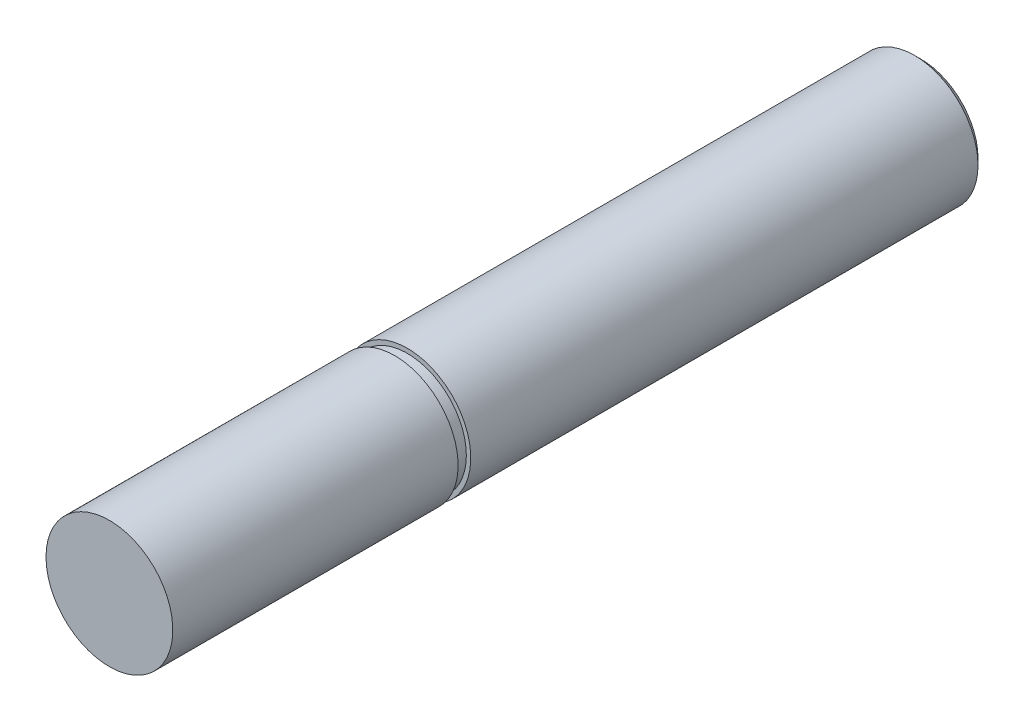
from build123d import *

# Parameters (mm, degrees)
SKETCH_1_R          = 5
EXTRUDE_1_DEPTH     = 104
SKETCH_2_W          = 3.498862739
SKETCH_2_H          = 1
CHAMFER_1_SIZE      = 0.5
SKETCH_4_W          = 44.49282487
SKETCH_4_H          = 52.981234512
CUT_EXTRUDE_2_DEPTH = 5


with BuildPart() as part:
    # 草图1 → 拉伸1 (new body)
    with BuildSketch(Plane.XY):
        with Locations(Location((0, 0, 0), (0, 0, 180))):
            Circle(SKETCH_1_R)
    extrude(amount=EXTRUDE_1_DEPTH)

    # 草图2 → 切除-旋转1 (revolve, cut)
    with BuildSketch(Plane(origin=(0, 0, 0), x_dir=(1, 0, 0), z_dir=(0, 1, 0)), mode=Mode.PRIVATE) as cut_revolve_1_sk:
        with Locations((6.39943137, -41)):
            Rectangle(SKETCH_2_W, SKETCH_2_H)
    revolve(cut_revolve_1_sk.sketch.rotate(Axis((0, 0, 104), (0, 0, -1)), 180), axis=Axis((0, 0, 104), (0, 0, -1)), mode=Mode.SUBTRACT)

    # 倒角1
    chamfer_1_edges = [part.edges().sort_by_distance(p)[0] for p in [
        (5, 0, 0),
        (5, 0, 104),
    ]]
    chamfer(chamfer_1_edges, length=CHAMFER_1_SIZE)

    # 草图4 → 拉伸2 (cut, symmetric)
    with BuildSketch(Plane(origin=(0, 0, 0), x_dir=(1, 0, 0), z_dir=(0, 1, 0))):
        with Locations((6.93564623, -90.490617256)):
            Rectangle(SKETCH_4_W, SKETCH_4_H)
    extrude(amount=CUT_EXTRUDE_2_DEPTH, both=True, mode=Mode.SUBTRACT)


solid = part.part
